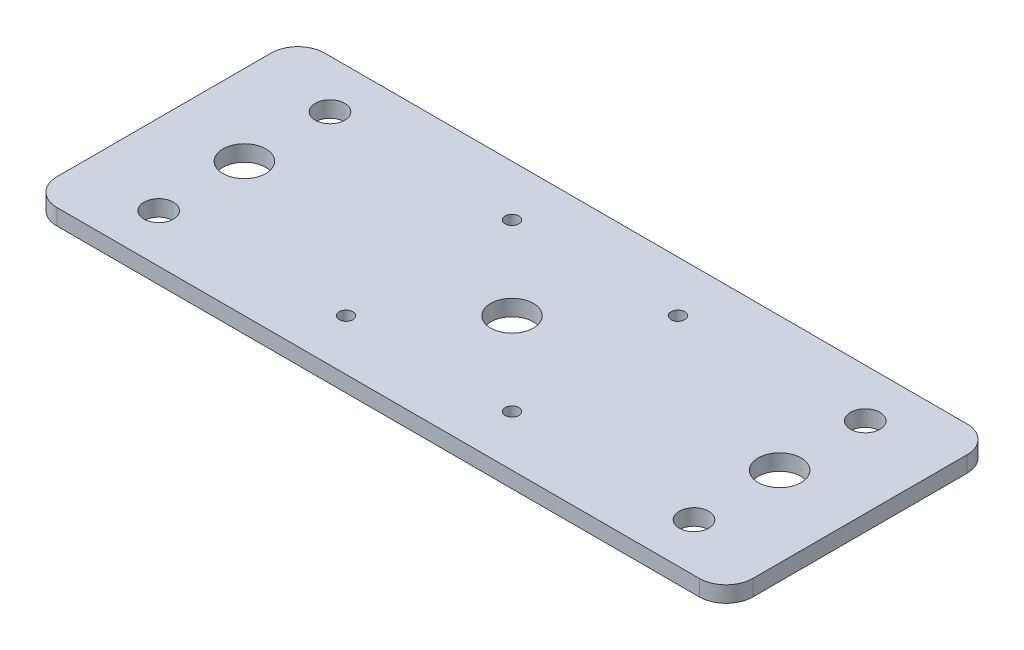
from build123d import *

# Parameters (mm, degrees)
SKETCH_1_R      = 2.75
SKETCH_1_R_2    = 4
SKETCH_1_R_3    = 1.283558174
EXTRUDE_1_DEPTH = 3


with BuildPart() as part:
    # 草图1 → 凸台-拉伸1 (new body)
    with BuildSketch(Plane(origin=(0, 0, 0), x_dir=(1, 0, 0), z_dir=(0, 1, 0))):
        with BuildLine():
            ThreePointArc((-65, 20), (-63.535533906, 23.535533906), (-60, 25))
            Line((-60, 25), (0, 25))
            Line((0, 25), (60, 25))
            ThreePointArc((60, 25), (63.535533906, 23.535533906), (65, 20))
            Line((65, 20), (65, -20))
            ThreePointArc((65, -20), (63.535533906, -23.535533906), (60, -25))
            Line((60, -25), (-60, -25))
            ThreePointArc((-60, -25), (-63.535533906, -23.535533906), (-65, -20))
            Line((-65, -20), (-65, 20))
        make_face()
        with Locations(Location((-50, 16, 0), (0, 0, 270))):
            Circle(SKETCH_1_R, mode=Mode.SUBTRACT)
        with Locations(Location((0, 0, 0), (0, 0, 270))):
            Circle(SKETCH_1_R_2, mode=Mode.SUBTRACT)
        with Locations(Location((15.5, 15.5, 0), (0, 0, 270))):
            Circle(SKETCH_1_R_3, mode=Mode.SUBTRACT)
        with Locations(Location((15.5, -15.5, 0), (0, 0, 270))):
            Circle(SKETCH_1_R_3, mode=Mode.SUBTRACT)
        with Locations(Location((-15.5, -15.5, 0), (0, 0, 270))):
            Circle(SKETCH_1_R_3, mode=Mode.SUBTRACT)
        with Locations(Location((-15.5, 15.5, 0), (0, 0, 270))):
            Circle(SKETCH_1_R_3, mode=Mode.SUBTRACT)
        with Locations(Location((50, 0, 0), (0, 0, 270))):
            Circle(SKETCH_1_R_2, mode=Mode.SUBTRACT)
        with Locations(Location((50, 16, 0), (0, 0, 270))):
            Circle(SKETCH_1_R, mode=Mode.SUBTRACT)
        with Locations(Location((50, -16, 0), (0, 0, 270))):
            Circle(SKETCH_1_R, mode=Mode.SUBTRACT)
        with Locations(Location((-50, -16, 0), (0, 0, 270))):
            Circle(SKETCH_1_R, mode=Mode.SUBTRACT)
        with Locations(Location((-50, 0, 0), (0, 0, 270))):
            Circle(SKETCH_1_R_2, mode=Mode.SUBTRACT)
    extrude(amount=EXTRUDE_1_DEPTH)


solid = part.part
